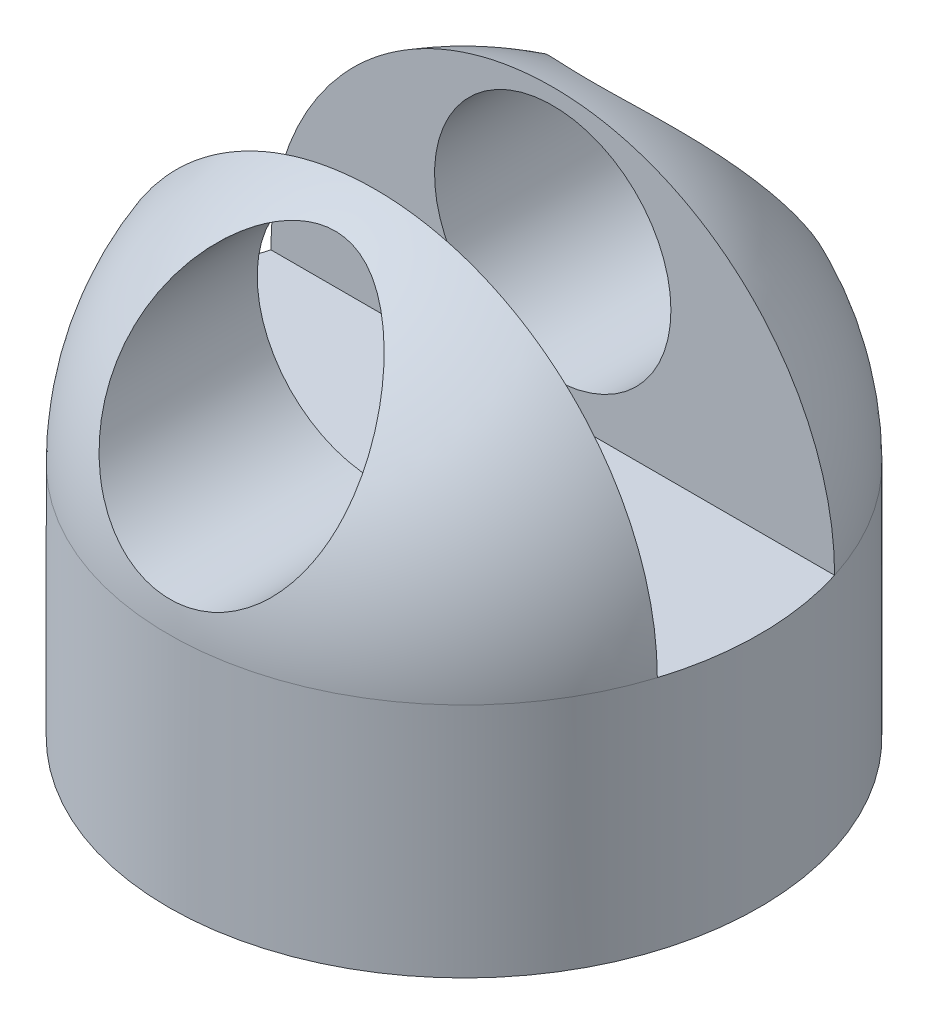
from build123d import *

# Parameters (mm, degrees)
SKETCH1_R               = 25
BOSS_EXTRUDE1_DEPTH     = 20
SKETCH5_W               = 7.5
SKETCH5_H               = 25.626943466
CUT_EXTRUDE1_DEPTH      = 25
CUT_EXTRUDE2_DEPTH      = 25
CUT_EXTRUDE2_DEPTH_BACK = 25
SKETCH6_R               = 10


with BuildPart() as part:
    # Sketch1 → Boss-Extrude1 (new body)
    with BuildSketch(Plane(origin=(0, 0, 0), x_dir=(1, 0, 0), z_dir=(0, 1, 0))):
        Circle(SKETCH1_R)
    extrude(amount=BOSS_EXTRUDE1_DEPTH)

    # Sketch4 → Revolve1 (revolve)
    with BuildSketch(Plane.XY):
        with BuildLine():
            Line((0, 45), (0, 20))
            Line((0, 20), (25, 20))
            ThreePointArc((25, 20), (17.67766953, 37.67766953), (0, 45))
        make_face()
    revolve(axis=Axis((0, 45, 0), (0, -1, 0)))

    # Sketch5 → Cut-Extrude1 (cut, symmetric)
    with BuildSketch(Plane(origin=(0, 0, 0), x_dir=(0, 0, -1), z_dir=(1, 0, 0))):
        with Locations((3.75, 32.813471733)):
            Rectangle(SKETCH5_W, SKETCH5_H)
    cut_extrude1 = extrude(amount=CUT_EXTRUDE1_DEPTH, both=True, mode=Mode.SUBTRACT)

    # Mirror1: Cut-Extrude1 across plane
    add(cut_extrude1.mirror(Plane.XY), mode=Mode.SUBTRACT)

    # Sketch6 → Cut-Extrude2 (cut, two sides: drawn at the far end of the back side and taken through both)
    with BuildSketch(Plane.XY.offset(-CUT_EXTRUDE2_DEPTH_BACK)):
        with Locations((0, 32.5)):
            Circle(SKETCH6_R)
    extrude(amount=CUT_EXTRUDE2_DEPTH + CUT_EXTRUDE2_DEPTH_BACK, mode=Mode.SUBTRACT)


solid = part.part
